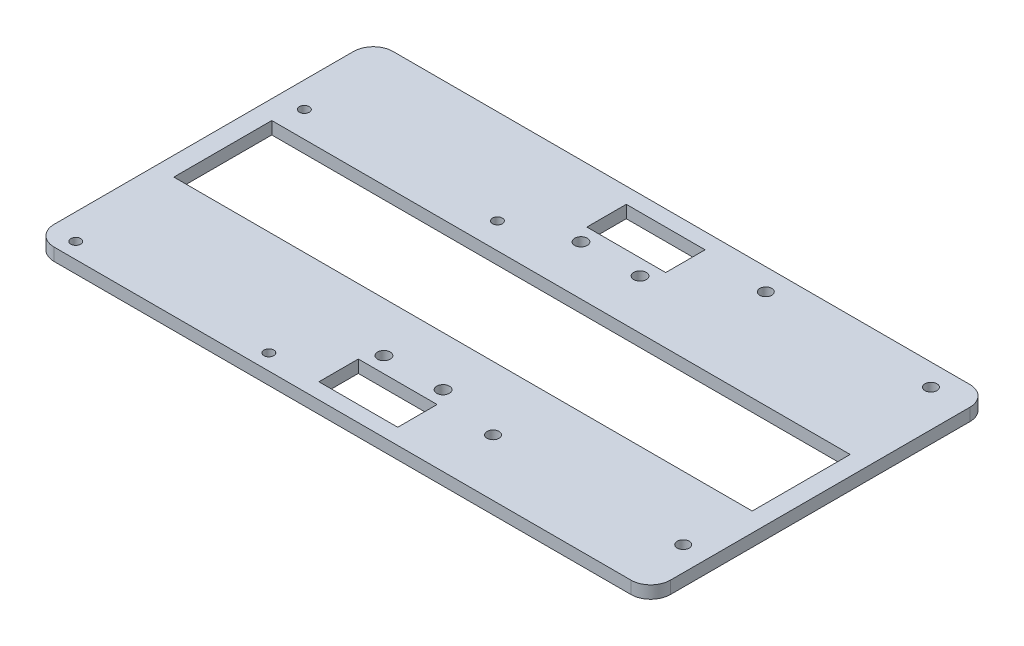
from build123d import *

# Parameters (mm, degrees)
SKETCH1_W           = 156.4
SKETCH1_H           = 86
BOSS_EXTRUDE1_DEPTH = 3.175
SKETCH3_R           = 1.25
SKETCH3_R_2         = 1.524
CUT_EXTRUDE2_DEPTH  = 90.299051647
SKETCH4_W           = 146.78
SKETCH4_H           = 24.86
CUT_EXTRUDE3_DEPTH  = 90.299051647
SKETCH5_R           = 1.6
CUT_EXTRUDE4_DEPTH  = 90.299051647
SKETCH6_W           = 20
SKETCH6_H           = 10
CUT_EXTRUDE5_DEPTH  = 90.299051647
FILLET1_R           = 5


with BuildPart() as part:
    # Sketch1 → Boss-Extrude1 (new body)
    with BuildSketch(Plane(origin=(0, 0, 0), x_dir=(1, 0, 0), z_dir=(0, 1, 0))):
        Rectangle(SKETCH1_W, SKETCH1_H)
    extrude(amount=BOSS_EXTRUDE1_DEPTH)

    # Sketch3 → Cut-Extrude2 (cut, through all)
    with BuildSketch(Plane.XZ):
        with Locations(Location((-22.7, -19, 0), (0, 0, 270))):
            Circle(SKETCH3_R)
        with Locations(Location((-71.7, -19, 0), (0, 0, 270))):
            Circle(SKETCH3_R)
        with Locations(Location((-71.7, 39, 0), (0, 0, 270))):
            Circle(SKETCH3_R)
        with Locations(Location((-22.7, 39, 0), (0, 0, 270))):
            Circle(SKETCH3_R)
        with Locations(Location((72.025, 28.575, 0), (0, 0, 270))):
            Circle(SKETCH3_R_2)
        with Locations(Location((23.765, 28.575, 0), (0, 0, 270))):
            Circle(SKETCH3_R_2)
        with Locations(Location((68.85, -37.465, 0), (0, 0, 270))):
            Circle(SKETCH3_R_2)
        with Locations(Location((26.94, -37.465, 0), (0, 0, 270))):
            Circle(SKETCH3_R_2)
    extrude(amount=-CUT_EXTRUDE2_DEPTH, mode=Mode.SUBTRACT)

    # Sketch4 → Cut-Extrude3 (cut, through all)
    with BuildSketch(Plane.XZ):
        Rectangle(SKETCH4_W, SKETCH4_H)
    extrude(amount=-CUT_EXTRUDE3_DEPTH, mode=Mode.SUBTRACT)

    # Sketch5 → Cut-Extrude4 (cut, through all)
    with BuildSketch(Plane.XZ):
        with Locations(Location((7.5, -25, 0), (0, 0, 270))):
            Circle(SKETCH5_R)
        with Locations(Location((-7.5, -25, 0), (0, 0, 270))):
            Circle(SKETCH5_R)
        with Locations(Location((-7.5, 25, 0), (0, 0, 270))):
            Circle(SKETCH5_R)
        with Locations(Location((7.5, 25, 0), (0, 0, 270))):
            Circle(SKETCH5_R)
    extrude(amount=-CUT_EXTRUDE4_DEPTH, mode=Mode.SUBTRACT)

    # Sketch6 → Cut-Extrude5 (cut, through all)
    with BuildSketch(Plane.XZ):
        with Locations((0, 34)):
            Rectangle(SKETCH6_W, SKETCH6_H)
        with Locations((0, -34)):
            Rectangle(SKETCH6_W, SKETCH6_H)
    extrude(amount=-CUT_EXTRUDE5_DEPTH, mode=Mode.SUBTRACT)

    # Fillet1
    fillet1_edges = [part.edges().sort_by_distance(p)[0] for p in [
        (78.2, 1.5875, 43),
        (-78.2, 1.5875, 43),
        (-78.2, 1.5875, -43),
        (78.2, 1.5875, -43),
    ]]
    fillet(fillet1_edges, radius=FILLET1_R)


solid = part.part
